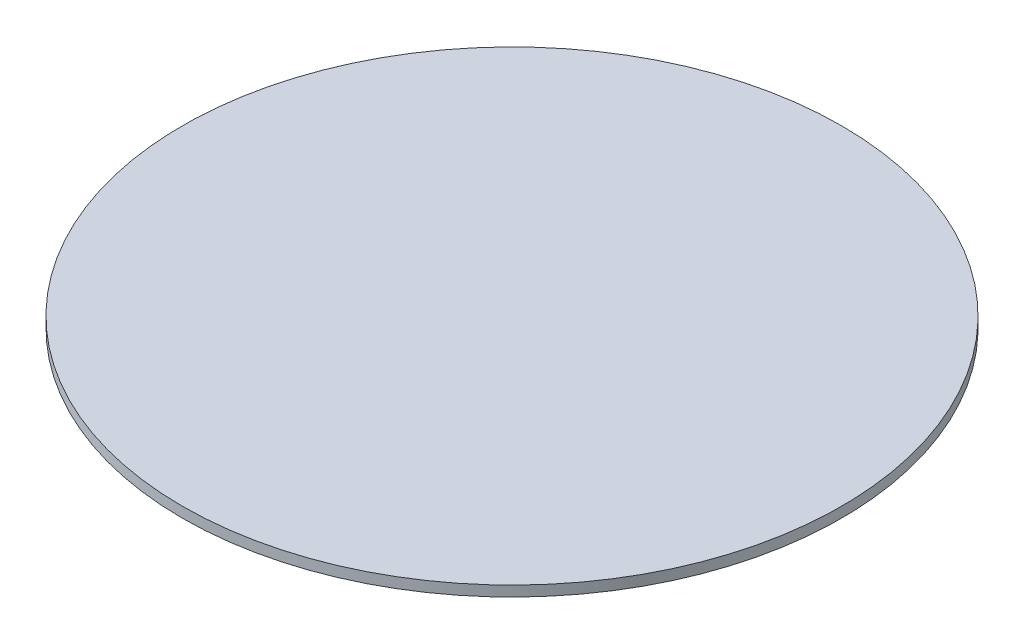
from build123d import *

# Parameters (mm, degrees)
SKETCH_1_R      = 193.5
EXTRUDE_1_DEPTH = 6.1


with BuildPart() as part:
    # 草图1 → 凸台-拉伸1 (new body)
    with BuildSketch(Plane(origin=(0, 0, 0), x_dir=(1, 0, 0), z_dir=(0, 1, 0))):
        with Locations(Location((0, 0, 0), (0, 0, 270))):
            Circle(SKETCH_1_R)
    extrude(amount=EXTRUDE_1_DEPTH)


solid = part.part
